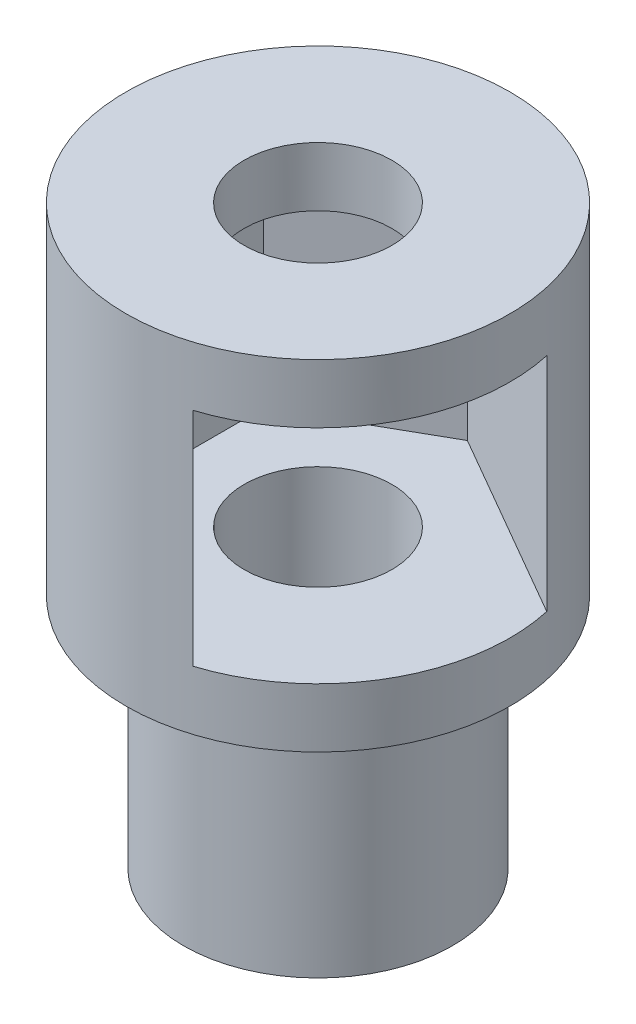
from build123d import *

# Parameters (mm, degrees)
SKETCH1_R           = 4.55
BOSS_EXTRUDE1_DEPTH = 8
SKETCH2_R           = 2.5
CUT_EXTRUDE1_DEPTH  = 8
SKETCH3_R           = 6.5
BOSS_EXTRUDE4_DEPTH = 9.5
CUT_EXTRUDE2_DEPTH  = 7.5
SKETCH6_R           = 6.5
BOSS_EXTRUDE5_DEPTH = 2
SKETCH7_R           = 2.5
CUT_EXTRUDE3_DEPTH  = 22.558061137


with BuildPart() as part:
    # Sketch1 → Boss-Extrude1 (new body)
    with BuildSketch(Plane(origin=(0, 0, 0), x_dir=(1, 0, 0), z_dir=(0, 1, 0))):
        with Locations(Location((0, 0, 0), (0, 0, 270))):
            Circle(SKETCH1_R)
    extrude(amount=BOSS_EXTRUDE1_DEPTH)

    # Sketch2 → Cut-Extrude1 (cut)
    with BuildSketch(Plane(origin=(0, 8, 0), x_dir=(1, 0, 0), z_dir=(0, 1, 0))):
        with Locations(Location((0, 0, 0), (0, 0, 270))):
            Circle(SKETCH2_R)
    extrude(amount=-CUT_EXTRUDE1_DEPTH, mode=Mode.SUBTRACT)

    # Sketch3 → Boss-Extrude4 (add)
    with BuildSketch(Plane(origin=(0, 8, 0), x_dir=(1, 0, 0), z_dir=(0, 1, 0))):
        with Locations(Location((0, 0, 0), (0, 0, 270))):
            Circle(SKETCH3_R)
    extrude(amount=BOSS_EXTRUDE4_DEPTH)

    # Sketch5 → Cut-Extrude2 (cut)
    with BuildSketch(Plane(origin=(0, 17.5, 0), x_dir=(1, 0, 0), z_dir=(0, 1, 0))):
        Polygon((-4.406153459, -2.521016119), (-4.406153459, 2.55966625), (-0.006153459, 5.061357304), (7.819258761, 0.543353452), (3.435994759, -7.048682503), align=None)
    extrude(amount=-CUT_EXTRUDE2_DEPTH, mode=Mode.SUBTRACT)

    # Sketch6 → Boss-Extrude5 (add)
    with BuildSketch(Plane(origin=(0, 17.5, 0), x_dir=(1, 0, 0), z_dir=(0, 1, 0))):
        with Locations(Location((0, 0, 0), (0, 0, 270))):
            Circle(SKETCH6_R)
    extrude(amount=BOSS_EXTRUDE5_DEPTH)

    # Sketch7 → Cut-Extrude3 (cut, through all)
    with BuildSketch(Plane.XZ):
        with Locations(Location((0, 0, 0), (0, 0, 90))):
            Circle(SKETCH7_R)
    extrude(amount=-CUT_EXTRUDE3_DEPTH, mode=Mode.SUBTRACT)


solid = part.part
